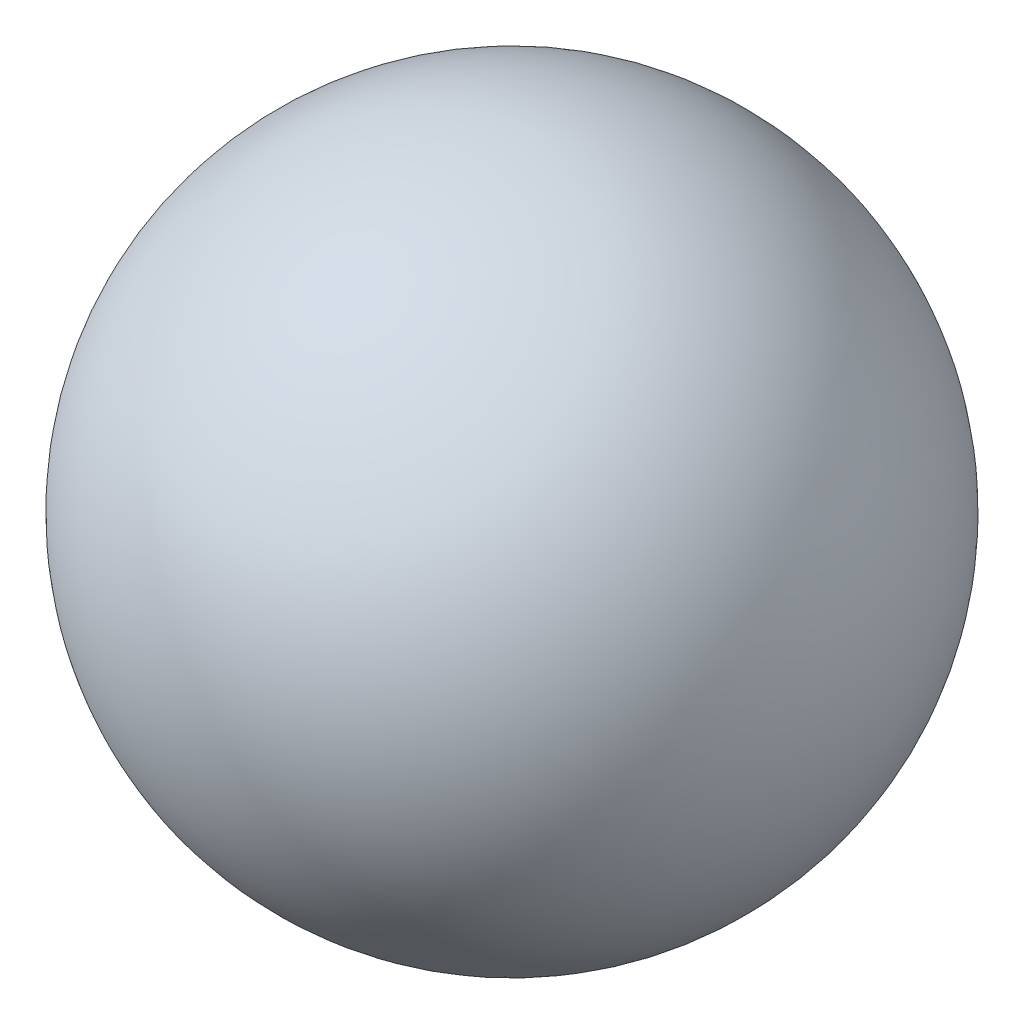
from build123d import *


with BuildPart() as part:
    # Sketch2 → Revolve2 (revolve)
    with BuildSketch(Plane(origin=(0, 0, 0), x_dir=(1, 0, 0), z_dir=(0, 1, 0))):
        with BuildLine():
            Line((0, 110), (0, -110))
            ThreePointArc((0, -110), (-110, 0), (0, 110))
        make_face()
    revolve(axis=Axis((0, 0, -110), (0, 0, 1)))


solid = part.part
